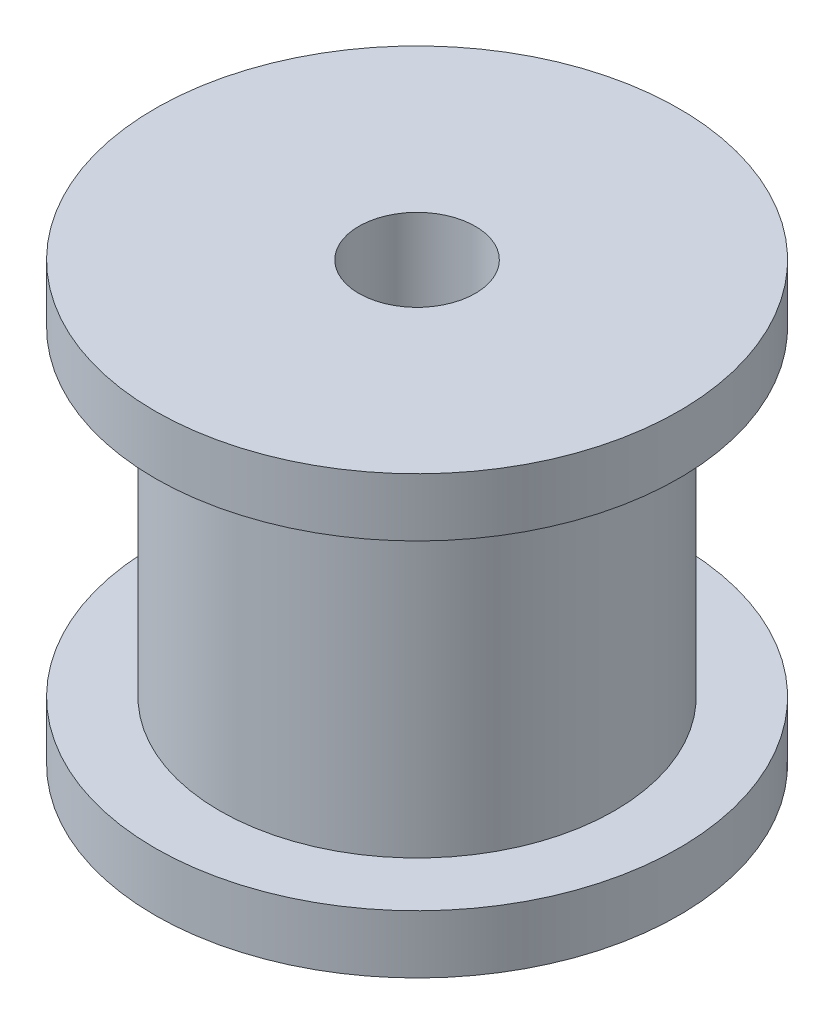
from build123d import *

# Parameters (mm, degrees)
SKETCH_1_R          = 9
EXTRUDE_1_DEPTH     = 2
SKETCH_2_R          = 6.78
EXTRUDE_2_DEPTH     = 11
SKETCH_3_R          = 9
EXTRUDE_3_DEPTH     = 2
SKETCH_4_R          = 2
CUT_EXTRUDE_1_DEPTH = 26


with BuildPart() as part:
    # 草图1 → 凸台-拉伸1 (new body)
    with BuildSketch(Plane(origin=(0, 0, 0), x_dir=(1, 0, 0), z_dir=(0, 1, 0))):
        with Locations(Location((0, 0, 0), (0, 0, 270))):
            Circle(SKETCH_1_R)
    extrude(amount=EXTRUDE_1_DEPTH)

    # 草图2 → 凸台-拉伸2 (add)
    with BuildSketch(Plane(origin=(0, 2, 0), x_dir=(1, 0, 0), z_dir=(0, 1, 0))):
        with Locations(Location((0, 0, 0), (0, 0, 270))):
            Circle(SKETCH_2_R)
    extrude(amount=EXTRUDE_2_DEPTH)

    # 草图3 → 凸台-拉伸3 (add)
    with BuildSketch(Plane(origin=(0, 13, 0), x_dir=(1, 0, 0), z_dir=(0, 1, 0))):
        with Locations(Location((0, 0, 0), (0, 0, 270))):
            Circle(SKETCH_3_R)
    extrude(amount=EXTRUDE_3_DEPTH)

    # 草图4 → 切除-拉伸1 (cut)
    with BuildSketch(Plane(origin=(0, 15, 0), x_dir=(1, 0, 0), z_dir=(0, 1, 0))):
        with Locations(Location((0, 0, 0), (0, 0, 270))):
            Circle(SKETCH_4_R)
    extrude(amount=-CUT_EXTRUDE_1_DEPTH, mode=Mode.SUBTRACT)


solid = part.part
